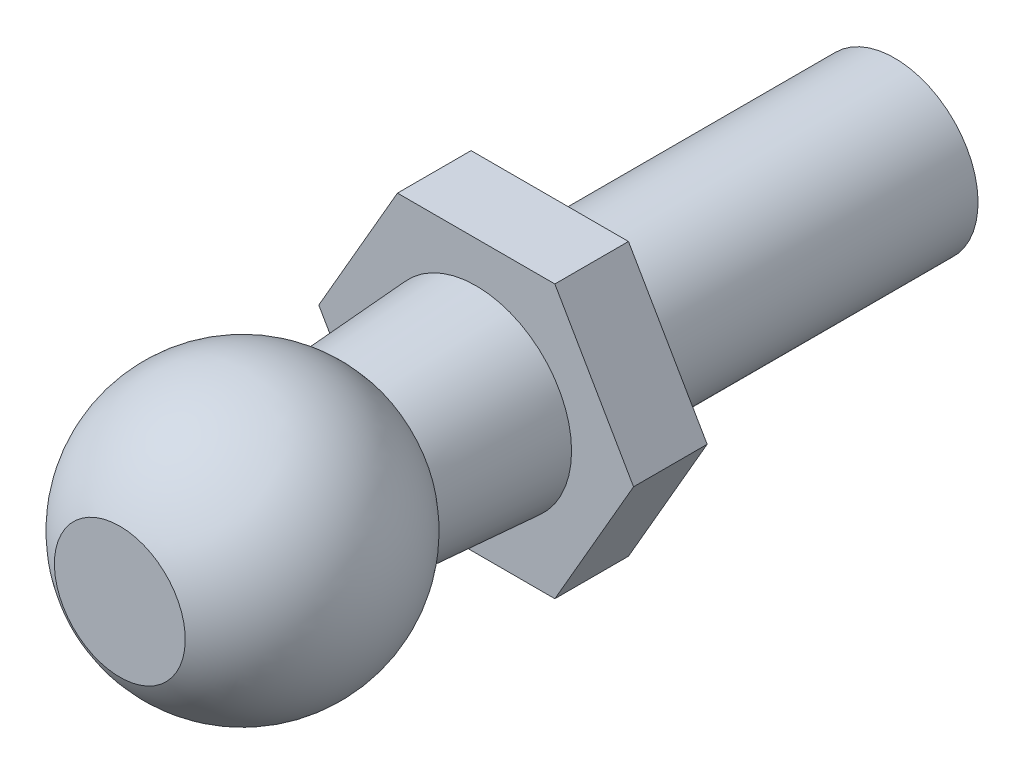
from build123d import *

# Parameters (mm, degrees)
SKETCH2_R          = 13.92587971
CUT_EXTRUDE1_DEPTH = 25.217488108


with BuildPart() as part:
    # Sketch1 → Revolve1 (revolve)
    with BuildSketch(Plane(origin=(0, 0, 0), x_dir=(0, 0, -1), z_dir=(1, 0, 0)), mode=Mode.PRIVATE) as revolve1_sk:
        with BuildLine():
            Line((0, 0), (36.094855332, 0))
            Line((36.094855332, 0), (36.094855332, 3.8862))
            Line((36.094855332, 3.8862), (20.029355332, 3.8862))
            Line((20.029355332, 3.8862), (20.029355332, 10.16))
            Line((20.029355332, 10.16), (16.600355332, 10.16))
            Line((16.600355332, 10.16), (16.600355332, 4.445))
            Line((16.600355332, 4.445), (10.758355332, 4.064))
            ThreePointArc((10.758355332, 4.064), (5.106033137, 6.448308954), (0, 3.048))
            Line((0, 3.048), (0, 0))
        make_face()
    revolve(revolve1_sk.sketch.rotate(Axis((0, 0, 0), (0, 0, -1)), 180), axis=Axis((0, 0, 0), (0, 0, -1)))

    # Sketch2 → Cut-Extrude1 (cut, through all)
    with BuildSketch(Plane.XY.offset(-16.600355332)):
        Circle(SKETCH2_R)
        Polygon((-3.666174209, 6.35), (3.666174209, 6.35), (7.332348419, 0), (3.666174209, -6.35), (-3.666174209, -6.35), (-7.332348419, 0), align=None, mode=Mode.SUBTRACT)
    extrude(amount=-CUT_EXTRUDE1_DEPTH, mode=Mode.SUBTRACT)


solid = part.part
